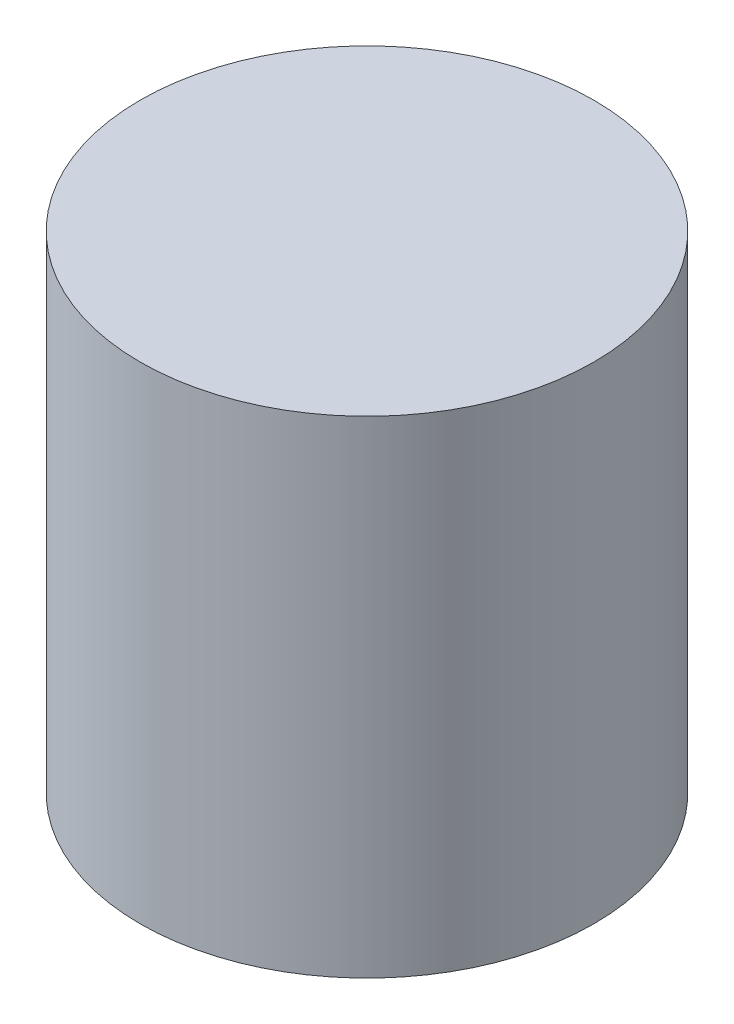
from build123d import *

# Parameters (mm, degrees)
SKETCH1_W = 25.4
SKETCH1_H = 54.47973101


with BuildPart() as part:
    # Sketch1 → Revolve1 (revolve)
    with BuildSketch(Plane.XY, mode=Mode.PRIVATE) as revolve1_sk:
        with Locations((12.7, 227.239865505)):
            Rectangle(SKETCH1_W, SKETCH1_H)
    revolve(revolve1_sk.sketch.rotate(Axis((0, 200, 0), (0, 1, 0)), 90), axis=Axis((0, 200, 0), (0, 1, 0)))


solid = part.part
